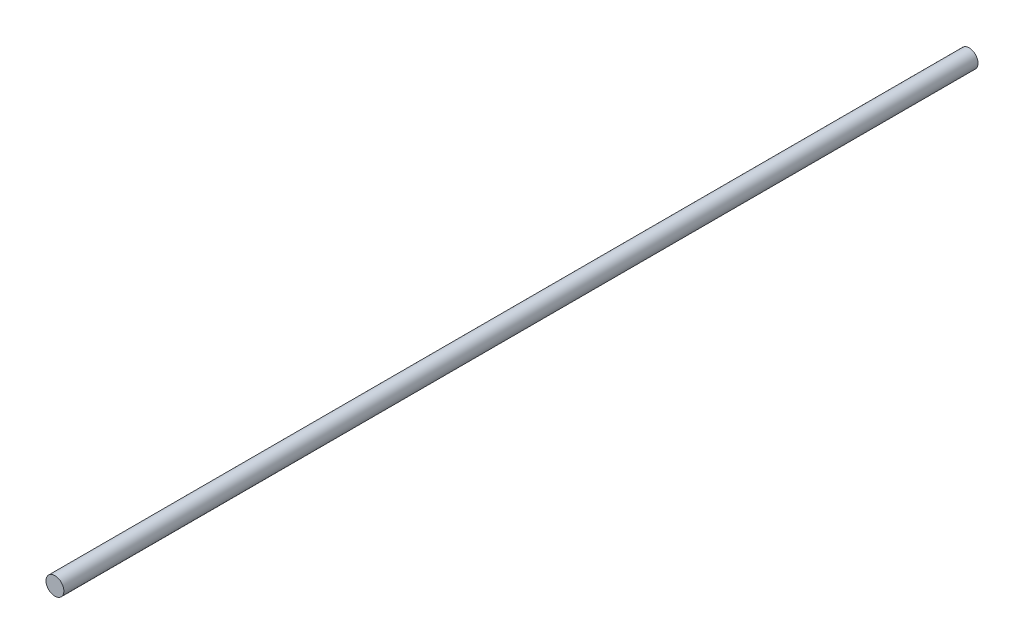
from build123d import *

# Parameters (mm, degrees)
SKETCH1_R           = 4
BOSS_EXTRUDE1_DEPTH = 410


with BuildPart() as part:
    # Sketch1 → Boss-Extrude1 (new body)
    with BuildSketch(Plane.XY):
        with Locations(Location((0, 0, 0), (0, 0, 180))):
            Circle(SKETCH1_R)
    extrude(amount=BOSS_EXTRUDE1_DEPTH)


solid = part.part
